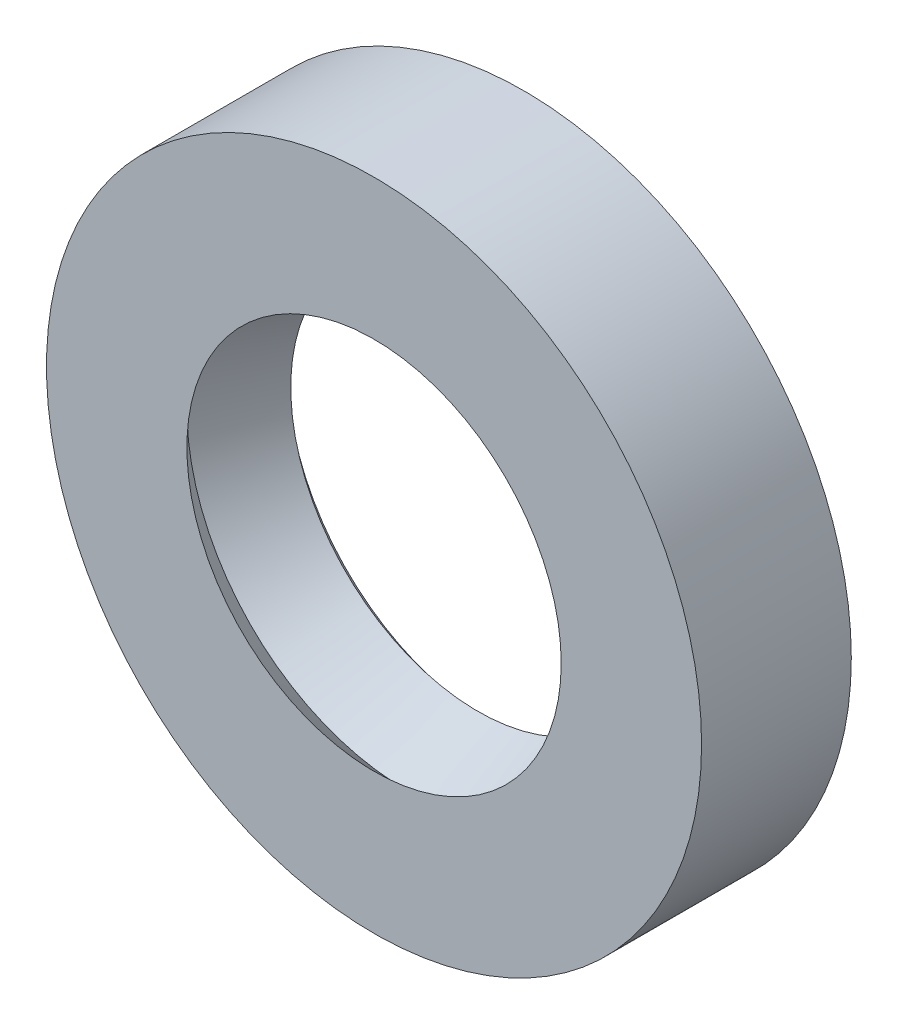
from build123d import *


with BuildPart() as part:
    # Sketch1 → Revolve3 (revolve)
    with BuildSketch(Plane(origin=(0, 0, 0), x_dir=(0, 0, -1), z_dir=(1, 0, 0)), mode=Mode.PRIVATE) as revolve3_sk:
        with BuildLine():
            Line((0, 15.75), (0, 17.5))
            Line((0, 17.5), (-8, 17.5))
            Line((-8, 17.5), (-8, 10))
            Line((-8, 10), (-6.25, 11.75))
            Line((-6.25, 11.75), (-2.45, 10))
            Line((-2.45, 10), (-1.75, 10.875))
            Line((-1.75, 10.875), (-1.75, 12.1))
            Line((-1.75, 12.1), (-2.45, 12.1))
            ThreePointArc((-2.45, 12.1), (-3.15, 12.8), (-3.85, 12.1))
            Line((-3.85, 12.1), (-6.25, 12.71))
            Line((-6.25, 12.71), (-6.25, 15.75))
            Line((-6.25, 15.75), (0, 15.75))
        make_face()
    revolve(revolve3_sk.sketch.rotate(Axis((0, 0, 20.663056601), (0, 0, -1)), 90), axis=Axis((0, 0, 20.663056601), (0, 0, -1)))


solid = part.part
